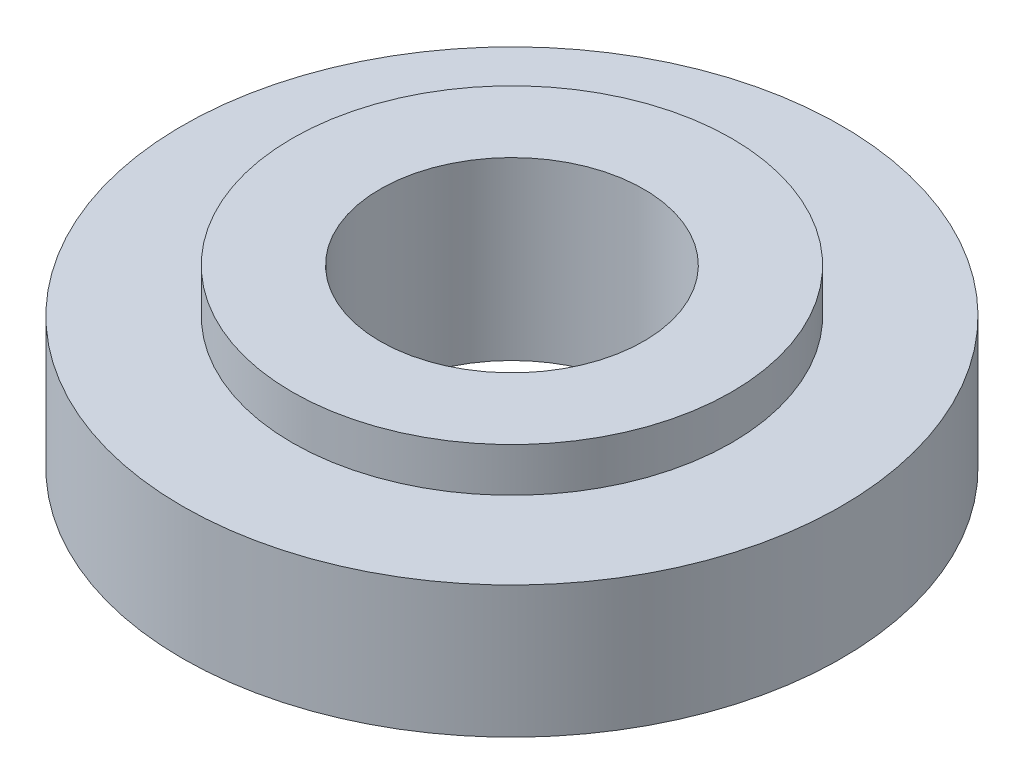
from build123d import *

# Parameters (mm, degrees)
SKETCH1_R           = 3.75
SKETCH1_R_2         = 1.5
BOSS_EXTRUDE1_DEPTH = 1.5
BOSS_EXTRUDE2_START = 0.5
SKETCH1_3_R         = 2.5
SKETCH1_3_R_2       = 1.5
BOSS_EXTRUDE2_DEPTH = 0.5


with BuildPart() as part:
    # Sketch1 → Boss-Extrude1 (new body)
    with BuildSketch(Plane(origin=(0, 0, 0), x_dir=(1, 0, 0), z_dir=(0, 1, 0))):
        Circle(SKETCH1_R)
        Circle(SKETCH1_R_2, mode=Mode.SUBTRACT)
    extrude(amount=-BOSS_EXTRUDE1_DEPTH)

    # Sketch1<3> → Boss-Extrude2 (add)
    with BuildSketch(Plane(origin=(0, 0, 0), x_dir=(1, 0, 0), z_dir=(0, 1, 0)).offset(BOSS_EXTRUDE2_START)):
        Circle(SKETCH1_3_R)
        Circle(SKETCH1_3_R_2, mode=Mode.SUBTRACT)
    extrude(amount=-BOSS_EXTRUDE2_DEPTH)


solid = part.part
